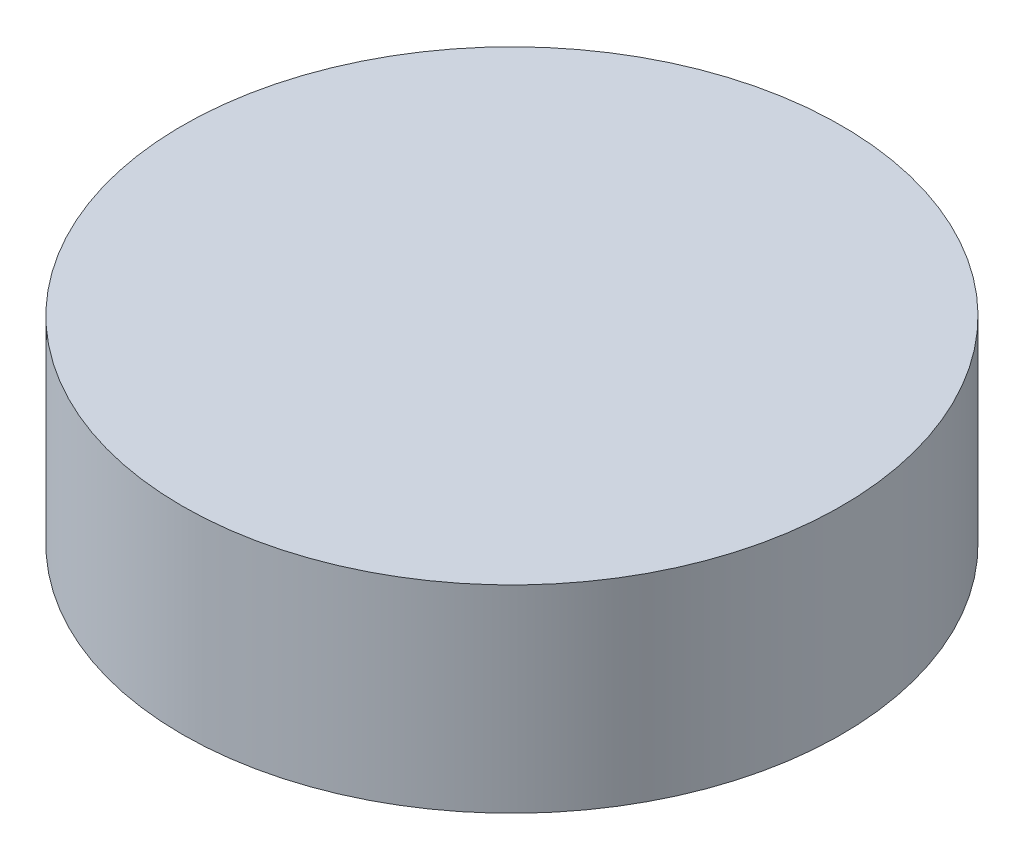
from build123d import *

# Parameters (mm, degrees)
SKETCH_1_R      = 20
EXTRUDE_1_DEPTH = 12


with BuildPart() as part:
    # 草图1 → 凸台-拉伸1 (new body)
    with BuildSketch(Plane(origin=(0, 0, 0), x_dir=(1, 0, 0), z_dir=(0, 1, 0))):
        with Locations(Location((0, 0, 0), (0, 0, 270))):
            Circle(SKETCH_1_R)
    extrude(amount=EXTRUDE_1_DEPTH)


solid = part.part
